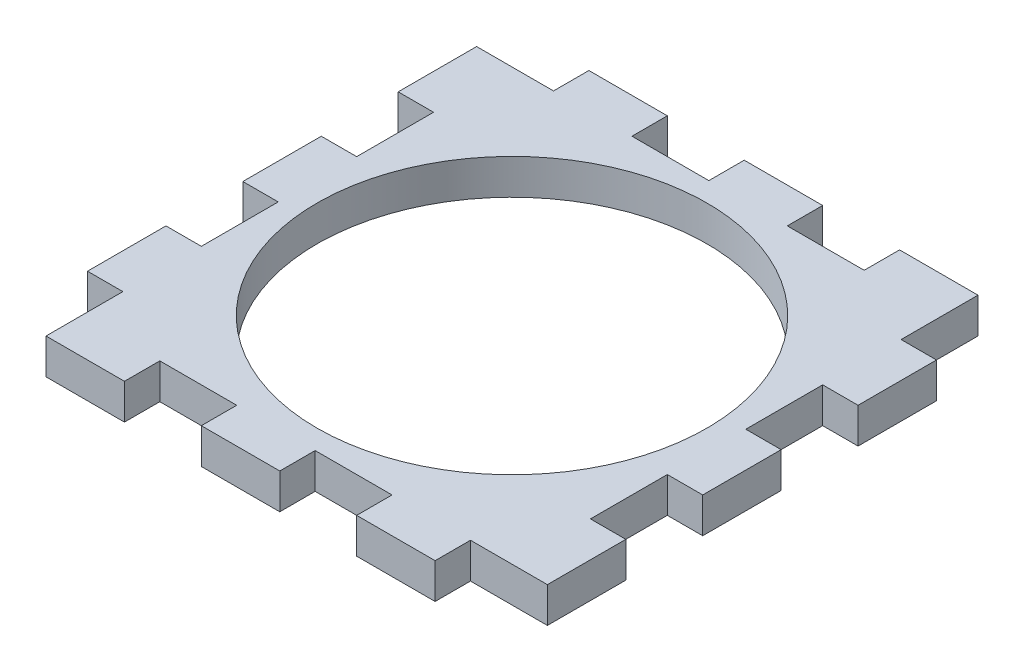
from build123d import *

# Parameters (mm, degrees)
SKETCH2_W                   = 38.65
SKETCH2_H                   = 38.65
BOSS_EXTRUDE1_DEPTH         = 1.5875
SKETCH8_W                   = 7.040833333
SKETCH8_H                   = 3.175
BOSS_EXTRUDE3_DEPTH         = 3.175
LPATTERN3_COUNT             = 3
LPATTERN3_PITCH             = 13.941666667
CIRPATTERN1_COUNT           = 4
CIRPATTERN1_COPY_1_SKETCH_W = 7.040833333
CIRPATTERN1_COPY_1_SKETCH_H = 3.175
CIRPATTERN1_COPY_1_DEPTH    = 3.175
CIRPATTERN1_COPY_2_SKETCH_W = 7.040833333
CIRPATTERN1_COPY_2_SKETCH_H = 3.175
CIRPATTERN1_COPY_2_DEPTH    = 3.175
CIRPATTERN1_COPY_3_SKETCH_W = 7.040833333
CIRPATTERN1_COPY_3_SKETCH_H = 3.175
CIRPATTERN1_COPY_3_DEPTH    = 3.175
CIRPATTERN1_COPY_4_SKETCH_W = 7.040833333
CIRPATTERN1_COPY_4_SKETCH_H = 3.175
CIRPATTERN1_COPY_4_DEPTH    = 3.175
CIRPATTERN1_COPY_5_SKETCH_W = 7.040833333
CIRPATTERN1_COPY_5_SKETCH_H = 3.175
CIRPATTERN1_COPY_5_DEPTH    = 3.175
CIRPATTERN1_COPY_6_SKETCH_W = 7.040833333
CIRPATTERN1_COPY_6_SKETCH_H = 3.175
CIRPATTERN1_COPY_6_DEPTH    = 3.175
SKETCH15_R                  = 17.5
CUT_EXTRUDE8_DEPTH          = 32.977814575


with BuildPart() as part:
    # Sketch2 → Boss-Extrude1 (new, symmetric)
    with BuildSketch(Plane(origin=(0, 0, 0), x_dir=(1, 0, 0), z_dir=(0, 1, 0))):
        Rectangle(SKETCH2_W, SKETCH2_H)
    extrude(amount=BOSS_EXTRUDE1_DEPTH, both=True)

    # Sketch8 → Boss-Extrude3 (add)
    with BuildSketch(Plane.ZY.offset(19.325)):
        with Locations((-15.804583334, 0)):
            Rectangle(SKETCH8_W, SKETCH8_H)
    boss_extrude3 = extrude(amount=BOSS_EXTRUDE3_DEPTH)

    # LPattern3: Boss-Extrude3 ×3
    with Locations(*[(0, 0, i * LPATTERN3_PITCH) for i in range(1, LPATTERN3_COUNT)]):
        add(boss_extrude3)

    # CirPattern1: Boss-Extrude3 ×4 about axis
    cirpattern1_axis = Axis((0, 0, 0), (0, 1, 0))
    for i in range(1, CIRPATTERN1_COUNT):
        add(boss_extrude3.rotate(cirpattern1_axis, i * 360 / CIRPATTERN1_COUNT))

    # CirPattern1 copy 1 sketch → CirPattern1 copy 1 (add)
    with BuildSketch(Plane(origin=(13.941666667, 0, 19.325), x_dir=(1, 0, 0), z_dir=(0, 0, 1))):
        with Locations((-15.804583334, 0)):
            Rectangle(CIRPATTERN1_COPY_1_SKETCH_W, CIRPATTERN1_COPY_1_SKETCH_H)
    extrude(amount=CIRPATTERN1_COPY_1_DEPTH)

    # CirPattern1 copy 2 sketch → CirPattern1 copy 2 (add)
    with BuildSketch(Plane(origin=(19.325, 0, -13.941666667), x_dir=(0, 0, -1), z_dir=(1, 0, 0))):
        with Locations((-15.804583334, 0)):
            Rectangle(CIRPATTERN1_COPY_2_SKETCH_W, CIRPATTERN1_COPY_2_SKETCH_H)
    extrude(amount=CIRPATTERN1_COPY_2_DEPTH)

    # CirPattern1 copy 3 sketch → CirPattern1 copy 3 (add)
    with BuildSketch(Plane(origin=(-13.941666667, 0, -19.325), x_dir=(-1, 0, 0), z_dir=(0, 0, -1))):
        with Locations((-15.804583334, 0)):
            Rectangle(CIRPATTERN1_COPY_3_SKETCH_W, CIRPATTERN1_COPY_3_SKETCH_H)
    extrude(amount=CIRPATTERN1_COPY_3_DEPTH)

    # CirPattern1 copy 4 sketch → CirPattern1 copy 4 (add)
    with BuildSketch(Plane(origin=(27.883333333, 0, 19.325), x_dir=(1, 0, 0), z_dir=(0, 0, 1))):
        with Locations((-15.804583334, 0)):
            Rectangle(CIRPATTERN1_COPY_4_SKETCH_W, CIRPATTERN1_COPY_4_SKETCH_H)
    extrude(amount=CIRPATTERN1_COPY_4_DEPTH)

    # CirPattern1 copy 5 sketch → CirPattern1 copy 5 (add)
    with BuildSketch(Plane(origin=(19.325, 0, -27.883333333), x_dir=(0, 0, -1), z_dir=(1, 0, 0))):
        with Locations((-15.804583334, 0)):
            Rectangle(CIRPATTERN1_COPY_5_SKETCH_W, CIRPATTERN1_COPY_5_SKETCH_H)
    extrude(amount=CIRPATTERN1_COPY_5_DEPTH)

    # CirPattern1 copy 6 sketch → CirPattern1 copy 6 (add)
    with BuildSketch(Plane(origin=(-27.883333333, 0, -19.325), x_dir=(-1, 0, 0), z_dir=(0, 0, -1))):
        with Locations((-15.804583334, 0)):
            Rectangle(CIRPATTERN1_COPY_6_SKETCH_W, CIRPATTERN1_COPY_6_SKETCH_H)
    extrude(amount=CIRPATTERN1_COPY_6_DEPTH)

    # Sketch15 → Cut-Extrude8 (cut, through all)
    with BuildSketch(Plane(origin=(0, 1.5875, 0), x_dir=(1, 0, 0), z_dir=(0, 1, 0))):
        Circle(SKETCH15_R)
    extrude(amount=-CUT_EXTRUDE8_DEPTH, mode=Mode.SUBTRACT)


solid = part.part
